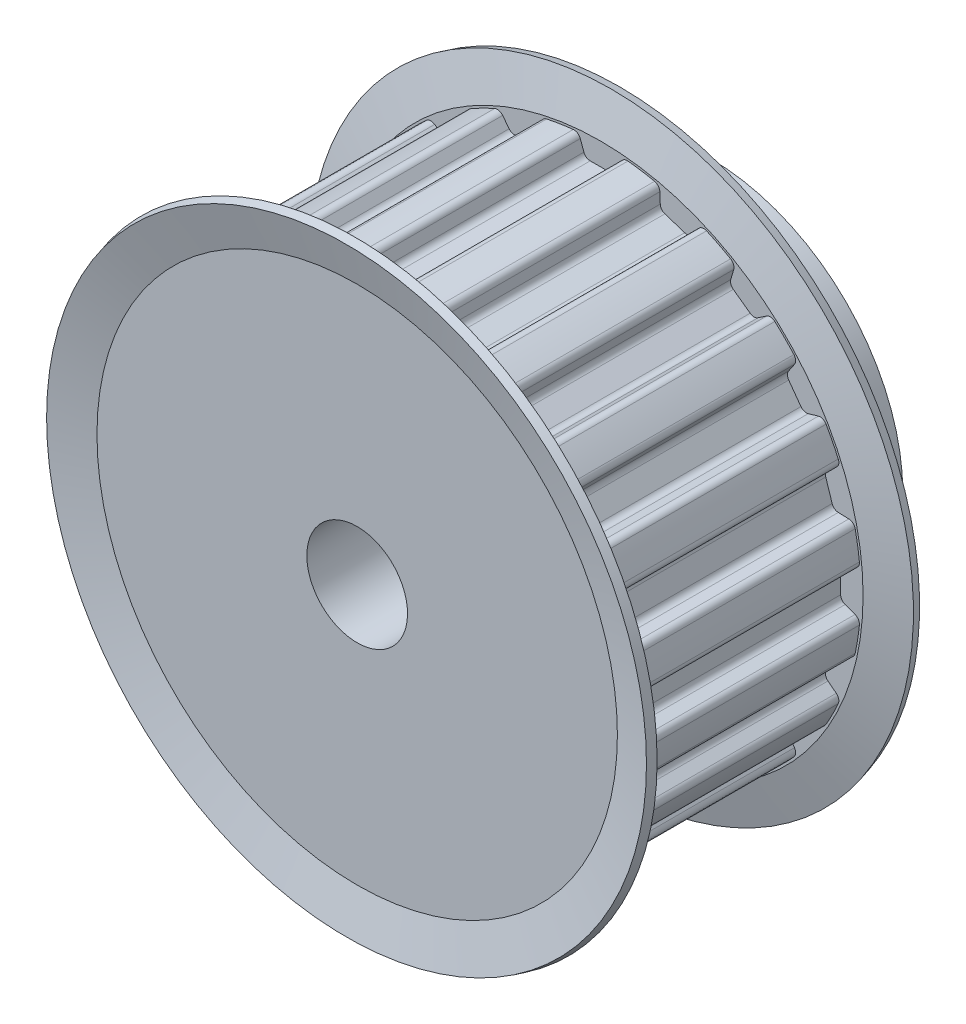
from build123d import *

# Parameters (mm, degrees)
SKETCH5_W           = 15
SKETCH5_H           = 15.5
SKETCH16_W          = 6
SKETCH16_H          = 11.5
SKETCH17_W          = 21
SKETCH17_H          = 3
CUT_TOOTH_REACH     = 32.356
PATTERN_TOOTH_COUNT = 20


with BuildPart() as part:
    # Sketch5 → body (revolve)
    with BuildSketch(Plane(origin=(0, 0, 0), x_dir=(0, 0, -1), z_dir=(1, 0, 0))):
        with Locations((7.5, 7.75)):
            Rectangle(SKETCH5_W, SKETCH5_H)
    revolve(axis=Axis((0, 0, 0), (0, 0, -1)))

    # Sketch16 → body-hub (revolve)
    with BuildSketch(Plane(origin=(0, 0, 0), x_dir=(0, 0, -1), z_dir=(1, 0, 0))):
        with Locations((18, 5.75)):
            Rectangle(SKETCH16_W, SKETCH16_H)
    revolve(axis=Axis((0, 0, -21), (0, 0, 1)))

    # Sketch17 → body-bore (revolve, cut)
    with BuildSketch(Plane(origin=(0, 0, 0), x_dir=(0, 0, -1), z_dir=(1, 0, 0))):
        with Locations((10.5, 1.5)):
            Rectangle(SKETCH17_W, SKETCH17_H)
    revolve(axis=Axis((0, 0, -21), (0, 0, 1)), mode=Mode.SUBTRACT)

    # Sketch23 → cut-tooth (cut, up to next)
    with BuildSketch(Plane.XY, mode=Mode.PRIVATE) as cut_tooth_sk1:
        with BuildLine():
            Line((1.628455774, 16.614218494), (-1.628455774, 16.614218494))
            Line((-1.628455774, 16.614218494), (-1.628455774, 15.414218494))
            ThreePointArc((-1.628455774, 15.414218494), (-1.374554347, 15.35570826), (-1.21055406, 15.153240268))
            Line((-1.21055406, 15.153240268), (-0.995794033, 14.563191943))
            ThreePointArc((-0.995794033, 14.563191943), (-0.849347559, 14.372339182), (-0.619916985, 14.3))
            Line((-0.619916985, 14.3), (0.619916985, 14.3))
            ThreePointArc((0.619916985, 14.3), (0.849347559, 14.372339182), (0.995794033, 14.563191943))
            Line((0.995794033, 14.563191943), (1.21055406, 15.153240268))
            ThreePointArc((1.21055406, 15.153240268), (1.374554347, 15.35570826), (1.628455774, 15.414218494))
            Line((1.628455774, 15.414218494), (1.628455774, 16.614218494))
        make_face()
    cut_tooth_tool1 = extrude(cut_tooth_sk1.sketch, amount=-CUT_TOOTH_REACH, mode=Mode.PRIVATE) & part.part
    cut_tooth = cut_tooth_tool1.solids().sort_by_distance((0, 15.585252, 0))[0]
    add(cut_tooth, mode=Mode.SUBTRACT)

    # pattern-tooth: cut-tooth ×20 about axis
    pattern_tooth_axis = Axis((0, 0, -15), (0, 0, 1))
    for i in range(1, PATTERN_TOOTH_COUNT):
        add(cut_tooth.rotate(pattern_tooth_axis, i * 360 / PATTERN_TOOTH_COUNT), mode=Mode.SUBTRACT)

    # Sketch25 → body-flange-front (revolve)
    with BuildSketch(Plane(origin=(0, 0, 0), x_dir=(0, 0, -1), z_dir=(1, 0, 0))):
        Polygon((0.5, 13.585), (0, 13.585), (0, 15.5), (-0.633974596, 17.866025404), (-0.133974596, 18), (0.5, 15.633974596), align=None)
    revolve(axis=Axis((0, 0, 0), (0, 0, -1)))

    # Sketch26 → body-flange-back (revolve)
    with BuildSketch(Plane(origin=(0, 0, 0), x_dir=(0, 0, -1), z_dir=(1, 0, 0))):
        Polygon((14.5, 13.585), (15, 13.585), (15, 15.5), (15.633974596, 17.866025404), (15.133974596, 18), (14.5, 15.633974596), align=None)
    revolve(axis=Axis((0, 0, -15), (0, 0, 1)))


solid = part.part
